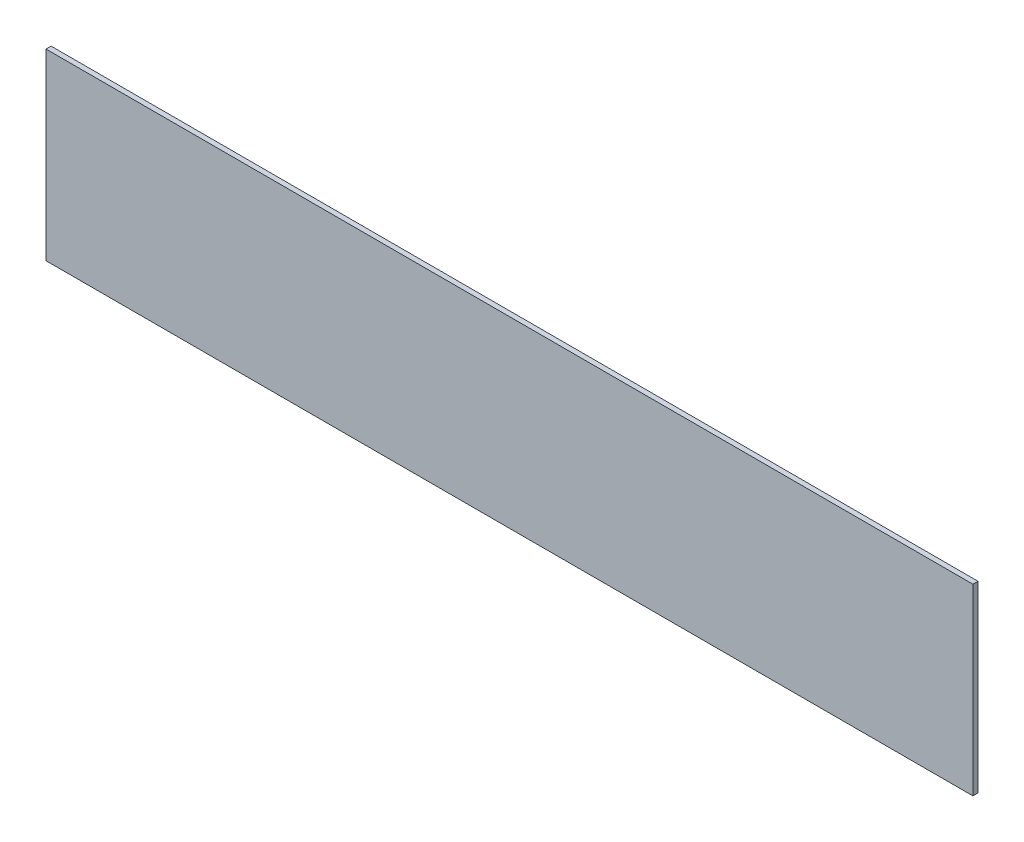
from build123d import *

# Parameters (mm, degrees)
TOPPING_KLAPE_KAT1_KULP_CUKURU_1_START = 26
SKETCH1_W                              = 182
SKETCH1_H                              = 36
TOPPING_KLAPE_KAT1_KULP_CUKURU_1_DEPTH = 1


with BuildPart() as part:
    # Sketch1 → TOPPING_klape_kat1_kulp_cukuru_1 (new body)
    with BuildSketch(Plane.XY.offset(TOPPING_KLAPE_KAT1_KULP_CUKURU_1_START)):
        with Locations((350, 1755)):
            Rectangle(SKETCH1_W, SKETCH1_H)
    extrude(amount=TOPPING_KLAPE_KAT1_KULP_CUKURU_1_DEPTH)


solid = part.part
